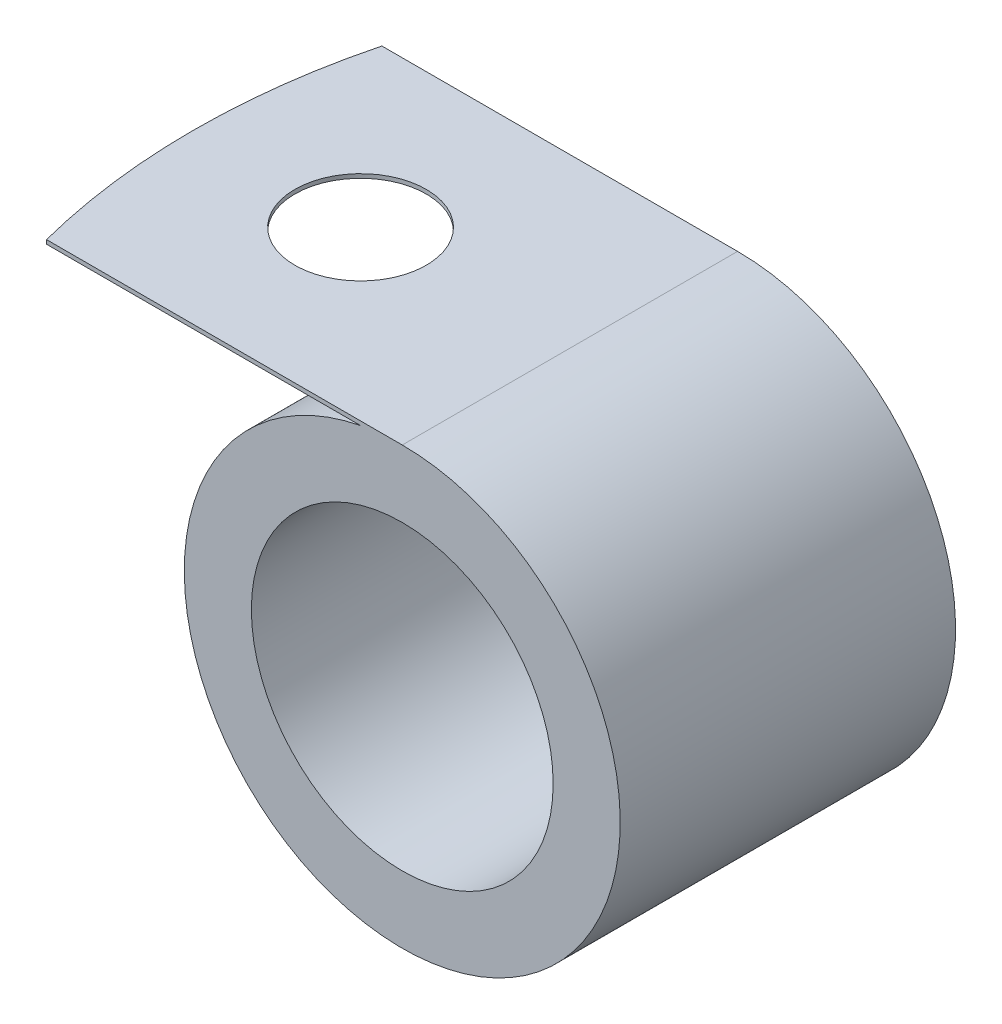
from build123d import *

# Parameters (mm, degrees)
SKETCH1_R           = 5.715
BOSS_EXTRUDE1_DEPTH = 6.35
CUT_EXTRUDE1_REACH  = 24.733
SKETCH2_R           = 2.4892


with BuildPart() as part:
    # Sketch1 → Boss-Extrude1 (new, symmetric)
    with BuildSketch(Plane.XY):
        with BuildLine():
            Line((0, 8.255), (-14.278891459, 8.255))
            Line((-14.278891459, 8.255), (-14.278891459, 8.1026))
            Line((-14.278891459, 8.1026), (-1.578891459, 8.1026))
            ThreePointArc((-1.578891459, 8.1026), (0.793114746, -8.216811669), (0, 8.255))
        make_face()
        Circle(SKETCH1_R, mode=Mode.SUBTRACT)
    extrude(amount=BOSS_EXTRUDE1_DEPTH, both=True)

    # Sketch2 → Cut-Extrude1 (cut, up to next)
    with BuildSketch(Plane(origin=(0, 8.255, 0), x_dir=(1, 0, 0), z_dir=(0, 1, 0)), mode=Mode.PRIVATE) as cut_extrude1_sk1:
        with Locations(Location((-7.928891459, 0, 0), (0, 0, 180))):
            Circle(SKETCH2_R)
    cut_extrude1_tool1 = extrude(cut_extrude1_sk1.sketch, amount=-CUT_EXTRUDE1_REACH, mode=Mode.PRIVATE) & part.part
    # Sketch2 → Cut-Extrude1 (cut, up to next)
    with BuildSketch(Plane(origin=(0, 8.255, 0), x_dir=(1, 0, 0), z_dir=(0, 1, 0)), mode=Mode.PRIVATE) as cut_extrude1_sk2:
        with BuildLine():
            ThreePointArc((-14.278891459, 0), (-14.076445744, 3.200509029), (-13.472335708, 6.35))
            Line((-13.472335708, 6.35), (-14.278891459, 6.35))
            Line((-14.278891459, 6.35), (-14.278891459, 0))
        make_face()
    cut_extrude1_tool2 = extrude(cut_extrude1_sk2.sketch, amount=-CUT_EXTRUDE1_REACH, mode=Mode.PRIVATE) & part.part
    # Sketch2 → Cut-Extrude1 (cut, up to next)
    with BuildSketch(Plane(origin=(0, 8.255, 0), x_dir=(1, 0, 0), z_dir=(0, 1, 0)), mode=Mode.PRIVATE) as cut_extrude1_sk3:
        with BuildLine():
            ThreePointArc((-13.472335708, -6.35), (-14.076445744, -3.200509029), (-14.278891459, 0))
            Line((-14.278891459, 0), (-14.278891459, -6.35))
            Line((-14.278891459, -6.35), (-13.472335708, -6.35))
        make_face()
    cut_extrude1_tool3 = extrude(cut_extrude1_sk3.sketch, amount=-CUT_EXTRUDE1_REACH, mode=Mode.PRIVATE) & part.part
    add(cut_extrude1_tool1.solids().sort_by_distance((-7.928891, 8.255, 0))[0], mode=Mode.SUBTRACT)
    add(cut_extrude1_tool2.solids().sort_by_distance((-14.037598, 8.255, -4.767585))[0], mode=Mode.SUBTRACT)
    add(cut_extrude1_tool3.solids().sort_by_distance((-14.037598, 8.255, 4.767585))[0], mode=Mode.SUBTRACT)


solid = part.part
